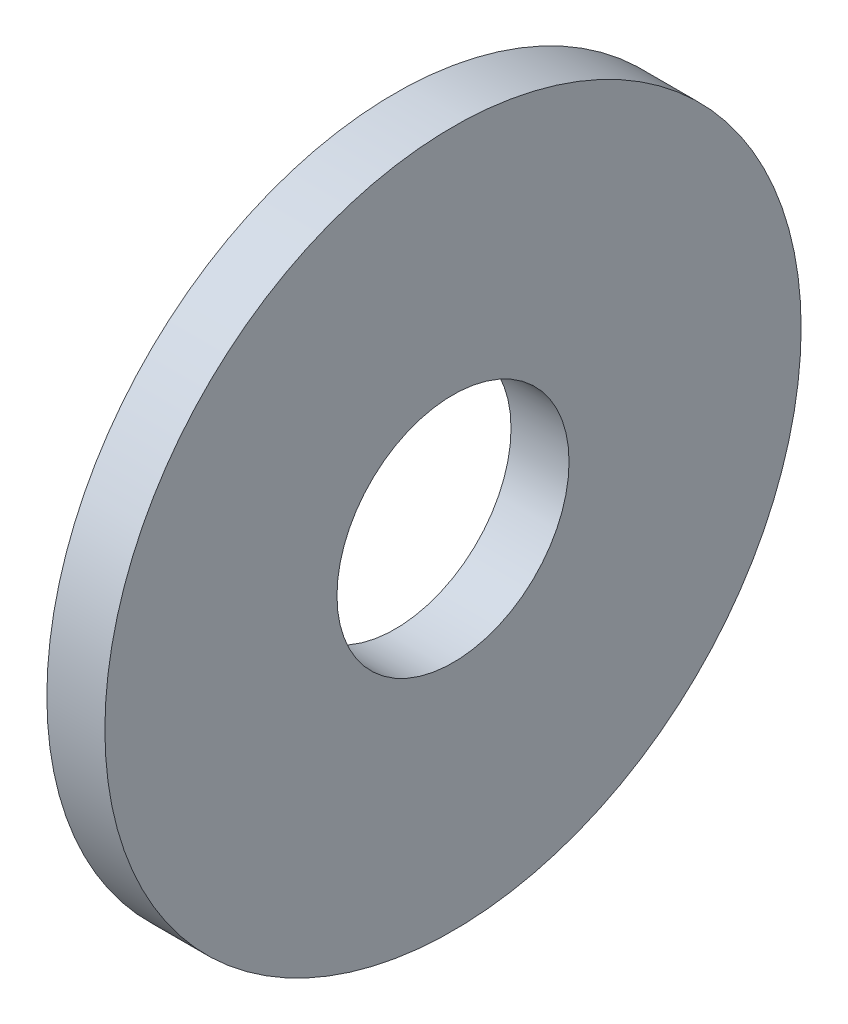
from build123d import *

# Parameters (mm, degrees)
SKETCH1_R           = 19.05
SKETCH1_R_2         = 6.35
BOSS_EXTRUDE1_DEPTH = 3.175


with BuildPart() as part:
    # Sketch1 → Boss-Extrude1 (new body)
    with BuildSketch(Plane(origin=(0, 0, 0), x_dir=(0, 0, -1), z_dir=(1, 0, 0))):
        Circle(SKETCH1_R)
        Circle(SKETCH1_R_2, mode=Mode.SUBTRACT)
    extrude(amount=BOSS_EXTRUDE1_DEPTH)


solid = part.part
